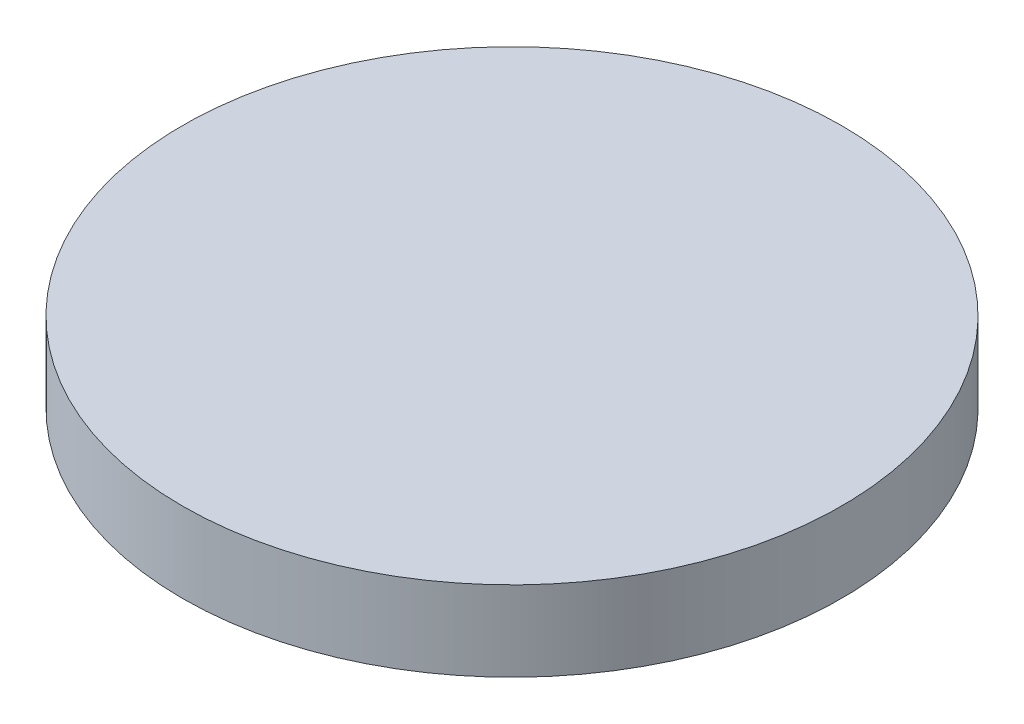
from build123d import *

# Parameters (mm, degrees)
SKETCH1_R    = 30.335461419
GEAR_1_DEPTH = 7.366


with BuildPart() as part:
    # Sketch1 → Gear 1 (new body)
    with BuildSketch(Plane(origin=(0, 0, 0), x_dir=(1, 0, 0), z_dir=(0, 1, 0))):
        with Locations(Location((0, 0, 0), (0, 0, 90))):
            Circle(SKETCH1_R)
    extrude(amount=GEAR_1_DEPTH)


solid = part.part
